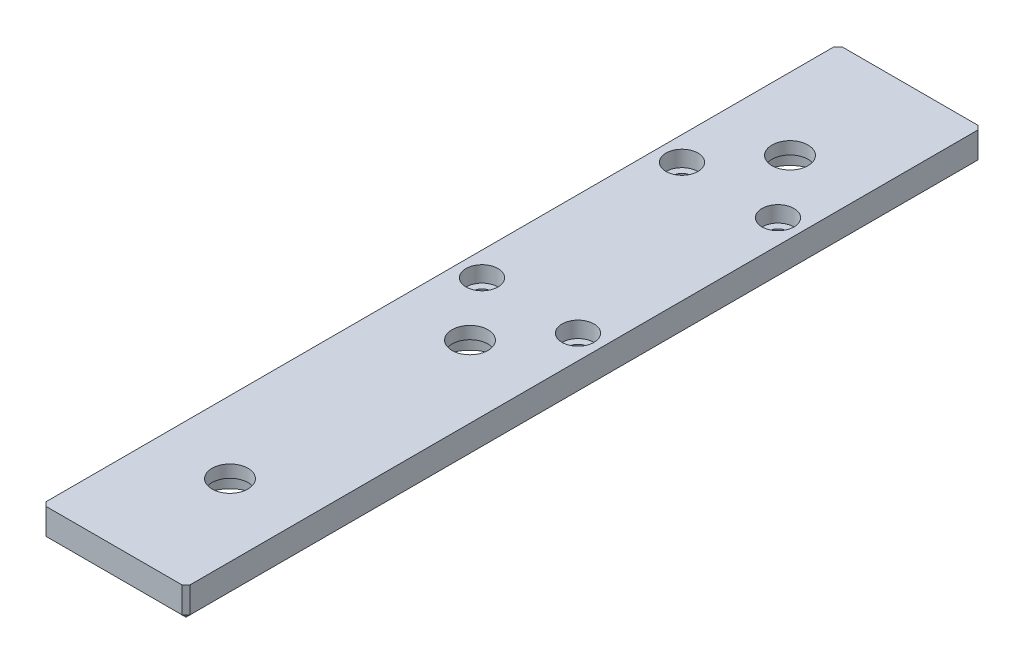
from build123d import *

# Parameters (mm, degrees)
SKETCH1_W                       = 36
SKETCH1_H                       = 199
BOSS_EXTRUDE1_DEPTH             = 7.5
CBORE_FOR_M4_SHCS1_D            = 4.5
CBORE_FOR_M4_SHCS1_CBORE_D      = 8
CBORE_FOR_M4_SHCS1_CBORE_DEPTH  = 4
CHAMFER1_SIZE                   = 1
CBORE_FOR_M8_SBHCS1_D           = 9
CBORE_FOR_M8_SBHCS1_CBORE_D     = 15
CBORE_FOR_M8_SBHCS1_CBORE_DEPTH = 4.4


with BuildPart() as part:
    # Sketch1 → Boss-Extrude1 (new body)
    with BuildSketch(Plane(origin=(0, 0, 0), x_dir=(1, 0, 0), z_dir=(0, 1, 0))):
        Rectangle(SKETCH1_W, SKETCH1_H)
    extrude(amount=BOSS_EXTRUDE1_DEPTH)

    # CBORE for M4 SHCS1 (through all)
    with Locations(Plane(origin=(0, 7.5, 0), x_dir=(1, 0, 0), z_dir=(0, 1, 0))):
        with Locations((-12, 54.5), (12, 54.5), (12, 4.5), (-12, 4.5)):
            CounterBoreHole(CBORE_FOR_M4_SHCS1_D / 2, CBORE_FOR_M4_SHCS1_CBORE_D / 2, CBORE_FOR_M4_SHCS1_CBORE_DEPTH)

    # Chamfer1
    chamfer1_edges = [part.edges().sort_by_distance(p)[0] for p in [
        (0, 0, 99.5),
        (-18, 0, 0),
        (0, 0, -99.5),
        (18, 0, 0),
        (18, 3.75, 99.5),
        (-18, 3.75, 99.5),
        (-18, 3.75, -99.5),
        (18, 3.75, -99.5),
    ]]
    chamfer(chamfer1_edges, length=CHAMFER1_SIZE)

    # CBORE for M8 SBHCS1 (through all)
    with Locations(Plane(origin=(0, 0, 0), x_dir=(-1, 0, 0), z_dir=(0, -1, 0))):
        with Locations((0, 69.5), (0, -10.5), (0, -70.5)):
            CounterBoreHole(CBORE_FOR_M8_SBHCS1_D / 2, CBORE_FOR_M8_SBHCS1_CBORE_D / 2, CBORE_FOR_M8_SBHCS1_CBORE_DEPTH)


solid = part.part
